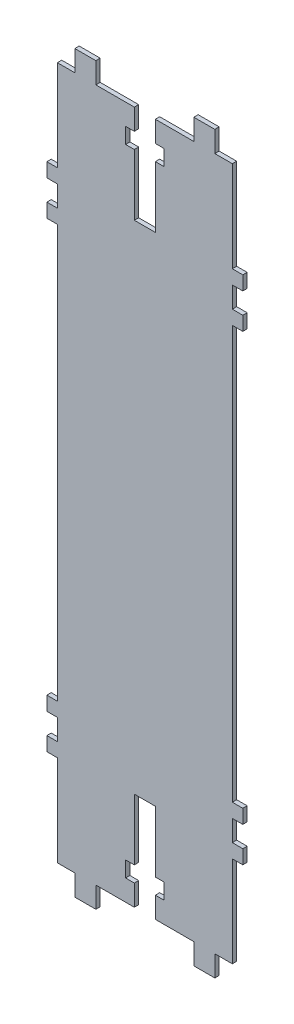
from build123d import *

# Parameters (mm, degrees)
BOSS_EXTRUDE1_DEPTH = 3


with BuildPart() as part:
    # Sketch1 → Boss-Extrude1 (new body)
    with BuildSketch(Plane.XY):
        Polygon((70.154954576, 166.975261474), (70.154954576, 176.656291712), (62.895015606, 176.656291712), (62.895015606, 239.582988265), (50.797896353, 239.582988265), (50.797896353, 254.102866205), (36.278018413, 254.102866205), (36.278018413, 239.582988265), (9.654351547, 239.582988265), (9.654351547, 225.059775488), (15.703744883, 225.059775488), (15.703744883, 214.199880562), (9.654351547, 214.199880562), (9.654351547, 171.815776593), (-4.867193811, 171.815776593), (-4.867193811, 214.199880562), (-10.916587147, 214.199880562), (-10.916587147, 225.059775488), (-4.867193811, 225.059775488), (-4.867193811, 239.582988265), (-31.484191004, 239.582988265), (-31.484191004, 254.102866205), (-46.004068944, 254.102866205), (-46.004068944, 239.582988265), (-58.102855615, 239.582988265), (-58.102855615, 176.656291712), (-65.362794585, 176.656291712), (-65.362794585, 166.975261474), (-58.102855615, 166.975261474), (-58.102855615, 152.455383534), (-65.362794585, 152.455383534), (-65.362794585, 142.776020713), (-58.102855615, 142.776020713), (-58.102855615, -142.784357804), (-65.362794585, -142.784357804), (-65.362794585, -152.465388043), (-58.102855615, -152.465388043), (-58.102855615, -166.985265983), (-65.362794585, -166.985265983), (-65.362794585, -176.661293967), (-58.102855615, -176.661293967), (-58.102855615, -239.579653428), (-46.004068944, -239.579653428), (-46.004068944, -254.102866205), (-31.484191004, -254.102866205), (-31.484191004, -239.582988265), (-4.867193811, -239.582988265), (-4.867193811, -225.063110325), (-10.916587147, -225.063110325), (-10.916587147, -214.218222162), (-4.867193811, -214.218222162), (-4.867193811, -171.824113684), (9.654351547, -171.824113684), (9.654351547, -214.218222162), (15.703744883, -214.218222162), (15.703744883, -225.063110325), (9.654351547, -225.063110325), (9.654351547, -239.582988265), (36.278018413, -239.582988265), (36.278018413, -254.102866205), (50.797896353, -254.102866205), (50.797896353, -239.579653428), (62.895015606, -239.579653428), (62.895015606, -176.661293967), (70.154954576, -176.661293967), (70.154954576, -166.985265983), (62.895015606, -166.985265983), (62.895015606, -152.465388043), (70.154954576, -152.465388043), (70.154954576, -142.784357804), (62.895015606, -142.784357804), (62.895015606, 142.776020713), (70.154954576, 142.776020713), (70.154954576, 152.455383534), (62.895015606, 152.455383534), (62.895015606, 166.975261474), align=None)
    extrude(amount=BOSS_EXTRUDE1_DEPTH)


solid = part.part
